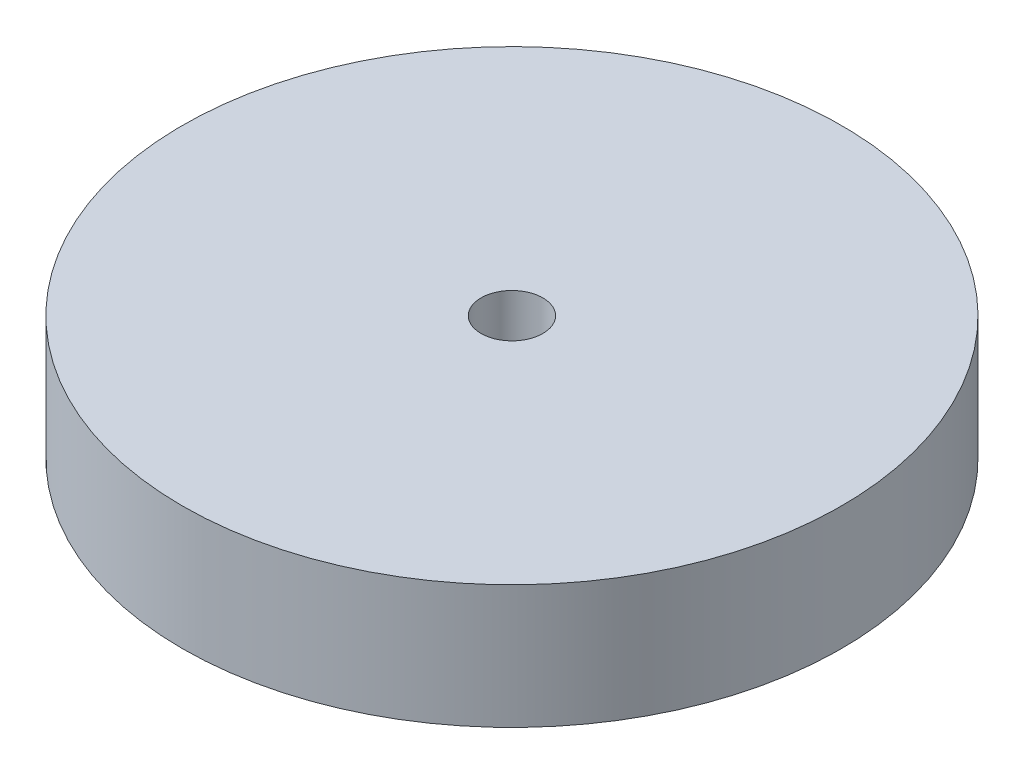
from build123d import *

# Parameters (mm, degrees)
SKETCH1_R           = 160
SKETCH1_R_2         = 15
BOSS_EXTRUDE1_DEPTH = 30


with BuildPart() as part:
    # Sketch1 → Boss-Extrude1 (new, symmetric)
    with BuildSketch(Plane(origin=(0, 0, 0), x_dir=(1, 0, 0), z_dir=(0, 1, 0))):
        with Locations(Location((0, 0, 0), (0, 0, 270))):
            Circle(SKETCH1_R)
        with Locations(Location((0, 0, 0), (0, 0, 270))):
            Circle(SKETCH1_R_2, mode=Mode.SUBTRACT)
    extrude(amount=BOSS_EXTRUDE1_DEPTH, both=True)


solid = part.part
